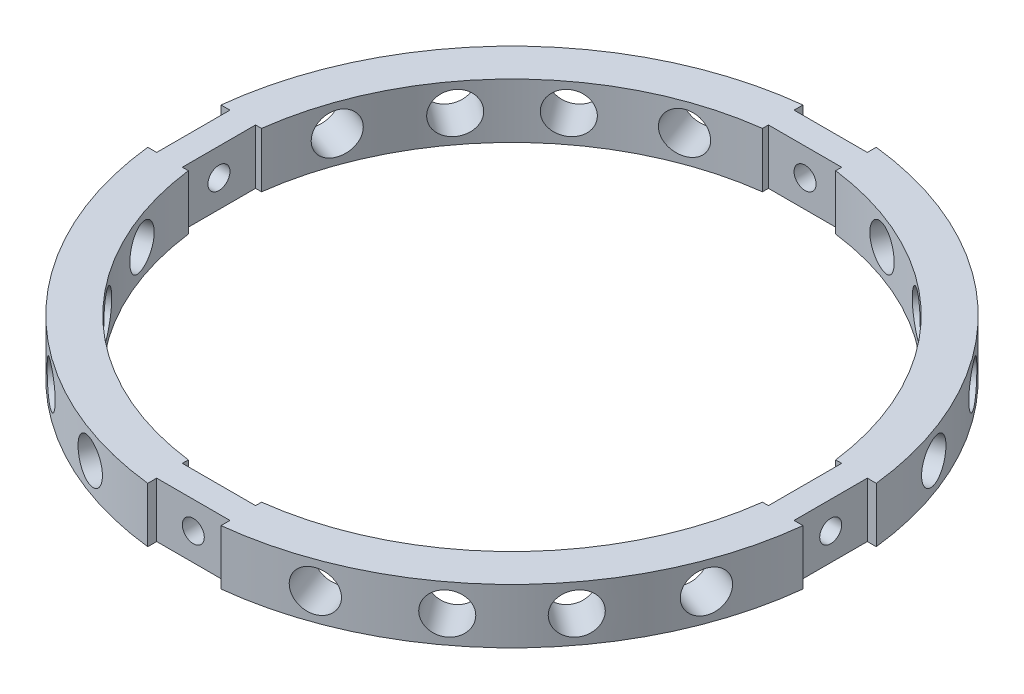
from build123d import *

# Parameters (mm, degrees)
BOSS_EXTRUDE1_DEPTH      = 7.5
BOSS_EXTRUDE1_DEPTH_BACK = 7.5
SKETCH1_R                = 90
SKETCH1_R_2              = 79
SKETCH6_W                = 20
SKETCH6_H                = 3
SKETCH6_W_2              = 3
SKETCH6_H_2              = 20
CUT_EXTRUDE4_DEPTH       = 129.16005618
SKETCH7_R                = 3
CUT_EXTRUDE5_DEPTH       = 198.960306939
SKETCH12_R               = 3
CUT_EXTRUDE8_DEPTH       = 198.960306943
SKETCH13_W               = 20
SKETCH13_H               = 3
SKETCH13_W_2             = 3
SKETCH13_H_2             = 20
CUT_EXTRUDE9_DEPTH       = 128.37739204
CUT_EXTRUDE10_DEPTH      = 127.71723991
CUT_EXTRUDE10_DEPTH_BACK = 127.71723991
SKETCH15_R               = 5.565
CUT_EXTRUDE11_DEPTH      = 127.71470806
CUT_EXTRUDE11_DEPTH_BACK = 127.71470806
SKETCH16_R               = 5.565
CUT_EXTRUDE12_DEPTH      = 127.717240057
CUT_EXTRUDE12_DEPTH_BACK = 127.717240057
SKETCH17_R               = 5.565
CUT_EXTRUDE13_DEPTH      = 127.71470806
CUT_EXTRUDE13_DEPTH_BACK = 127.71470806
SKETCH18_R               = 5.565
CUT_EXTRUDE14_DEPTH      = 127.716955901
CUT_EXTRUDE14_DEPTH_BACK = 127.716955901
SKETCH20_R               = 5.565
CUT_EXTRUDE15_DEPTH      = 127.716044845
CUT_EXTRUDE15_DEPTH_BACK = 127.716044845
SKETCH21_R               = 5.565
CUT_EXTRUDE16_DEPTH      = 127.716044845
CUT_EXTRUDE16_DEPTH_BACK = 127.716044845
SKETCH22_R               = 5.565
CUT_EXTRUDE17_DEPTH      = 127.716955901
CUT_EXTRUDE17_DEPTH_BACK = 127.716955901
SKETCH23_R               = 5.565


with BuildPart() as part:
    # Sketch1 → Boss-Extrude1 (new, two sides: drawn at the far end of the back side and taken through both)
    with BuildSketch(Plane(origin=(0, 0, 0), x_dir=(1, 0, 0), z_dir=(0, 1, 0)).offset(-BOSS_EXTRUDE1_DEPTH_BACK)):
        Circle(SKETCH1_R)
        Circle(SKETCH1_R_2, mode=Mode.SUBTRACT)
    extrude(amount=BOSS_EXTRUDE1_DEPTH + BOSS_EXTRUDE1_DEPTH_BACK)

    # Sketch6 → Cut-Extrude4 (cut, through all)
    with BuildSketch(Plane(origin=(0, 7.5, 0), x_dir=(1, 0, 0), z_dir=(0, 1, 0))):
        with Locations((0, -88.5)):
            Rectangle(SKETCH6_W, SKETCH6_H)
        with Locations((0, 88.5)):
            Rectangle(SKETCH6_W, SKETCH6_H)
        with Locations((88.5, 0)):
            Rectangle(SKETCH6_W_2, SKETCH6_H_2)
        with Locations((-88.5, 0)):
            Rectangle(SKETCH6_W_2, SKETCH6_H_2)
    extrude(amount=-CUT_EXTRUDE4_DEPTH, mode=Mode.SUBTRACT)

    # Sketch7 → Cut-Extrude5 (cut, through all)
    with BuildSketch(Plane.ZY.offset(87)):
        Circle(SKETCH7_R)
    extrude(amount=-CUT_EXTRUDE5_DEPTH, mode=Mode.SUBTRACT)

    # Sketch12 → Cut-Extrude8 (cut, through all)
    with BuildSketch(Plane.XY.offset(87)):
        Circle(SKETCH12_R)
    extrude(amount=-CUT_EXTRUDE8_DEPTH, mode=Mode.SUBTRACT)

    # Sketch13 → Cut-Extrude9 (cut, through all)
    with BuildSketch(Plane(origin=(0, 7.5, 0), x_dir=(1, 0, 0), z_dir=(0, 1, 0))):
        with Locations((0, -78.5)):
            Rectangle(SKETCH13_W, SKETCH13_H)
        with Locations((0, 78.5)):
            Rectangle(SKETCH13_W, SKETCH13_H)
        with Locations((-78.5, 0)):
            Rectangle(SKETCH13_W_2, SKETCH13_H_2)
        with Locations((78.5, 0)):
            Rectangle(SKETCH13_W_2, SKETCH13_H_2)
    extrude(amount=-CUT_EXTRUDE9_DEPTH, mode=Mode.SUBTRACT)

    # Sketch15 → Cut-Extrude10 (cut, two sides: drawn at the far end of the back side and taken through both)
    with BuildSketch(Plane(origin=(0.004134812, 0, -0.001504948), x_dir=(-0.3420201433256595, 0, -0.9396926207859118), z_dir=(0.9396926207859119, 0, -0.34202014332565955)).offset(-CUT_EXTRUDE10_DEPTH_BACK)):
        Circle(SKETCH15_R)
    extrude(amount=CUT_EXTRUDE10_DEPTH + CUT_EXTRUDE10_DEPTH_BACK, mode=Mode.SUBTRACT)

    # Sketch16 → Cut-Extrude11 (cut, two sides: drawn at the far end of the back side and taken through both)
    with BuildSketch(Plane(origin=(0.000547756, 0, -0.001504948), x_dir=(-0.939692620785907, 0, -0.34202014332567277), z_dir=(0.34202014332567277, 0, -0.939692620785907)).offset(-CUT_EXTRUDE11_DEPTH_BACK)):
        Circle(SKETCH16_R)
    extrude(amount=CUT_EXTRUDE11_DEPTH + CUT_EXTRUDE11_DEPTH_BACK, mode=Mode.SUBTRACT)

    # Sketch17 → Cut-Extrude12 (cut, two sides: drawn at the far end of the back side and taken through both)
    with BuildSketch(Plane(origin=(-0.001504948, 0, -0.004134812), x_dir=(-0.9396926207859106, 0, 0.3420201433256628), z_dir=(-0.34202014332566283, 0, -0.9396926207859106)).offset(-CUT_EXTRUDE12_DEPTH_BACK)):
        Circle(SKETCH17_R)
    extrude(amount=CUT_EXTRUDE12_DEPTH + CUT_EXTRUDE12_DEPTH_BACK, mode=Mode.SUBTRACT)

    # Sketch18 → Cut-Extrude13 (cut, two sides: drawn at the far end of the back side and taken through both)
    with BuildSketch(Plane(origin=(-0.001504948, 0, -0.000547756), x_dir=(-0.34202014332566943, 0, 0.9396926207859081), z_dir=(-0.9396926207859081, 0, -0.34202014332566943)).offset(-CUT_EXTRUDE13_DEPTH_BACK)):
        with Locations((0.475660887, 0)):
            Circle(SKETCH18_R)
    extrude(amount=CUT_EXTRUDE13_DEPTH + CUT_EXTRUDE13_DEPTH_BACK, mode=Mode.SUBTRACT)

    # Sketch20 → Cut-Extrude14 (cut, two sides: drawn at the far end of the back side and taken through both)
    with BuildSketch(Plane(origin=(0.002986629, 0, -0.002250587), x_dir=(-0.6018150231520415, 0, -0.7986355100472979), z_dir=(0.7986355100472979, 0, -0.6018150231520415)).offset(-CUT_EXTRUDE14_DEPTH_BACK)):
        Circle(SKETCH20_R)
    extrude(amount=CUT_EXTRUDE14_DEPTH + CUT_EXTRUDE14_DEPTH_BACK, mode=Mode.SUBTRACT)

    # Sketch21 → Cut-Extrude15 (cut, two sides: drawn at the far end of the back side and taken through both)
    with BuildSketch(Plane(origin=(0.001695939, 0, -0.002250587), x_dir=(-0.7986355100472899, 0, -0.601815023152052), z_dir=(0.601815023152052, 0, -0.7986355100472899)).offset(-CUT_EXTRUDE15_DEPTH_BACK)):
        Circle(SKETCH21_R)
    extrude(amount=CUT_EXTRUDE15_DEPTH + CUT_EXTRUDE15_DEPTH_BACK, mode=Mode.SUBTRACT)

    # Sketch22 → Cut-Extrude16 (cut, two sides: drawn at the far end of the back side and taken through both)
    with BuildSketch(Plane(origin=(0.002250587, 0, 0.001695939), x_dir=(0.6018150231520437, 0, -0.7986355100472963), z_dir=(0.7986355100472963, 0, 0.6018150231520437)).offset(-CUT_EXTRUDE16_DEPTH_BACK)):
        Circle(SKETCH22_R)
    extrude(amount=CUT_EXTRUDE16_DEPTH + CUT_EXTRUDE16_DEPTH_BACK, mode=Mode.SUBTRACT)

    # Sketch23 → Cut-Extrude17 (cut, two sides: drawn at the far end of the back side and taken through both)
    with BuildSketch(Plane(origin=(0.002250587, 0, 0.002986629), x_dir=(0.7986355100472916, 0, -0.6018150231520499), z_dir=(0.6018150231520499, 0, 0.7986355100472916)).offset(-CUT_EXTRUDE17_DEPTH_BACK)):
        Circle(SKETCH23_R)
    extrude(amount=CUT_EXTRUDE17_DEPTH + CUT_EXTRUDE17_DEPTH_BACK, mode=Mode.SUBTRACT)


solid = part.part
